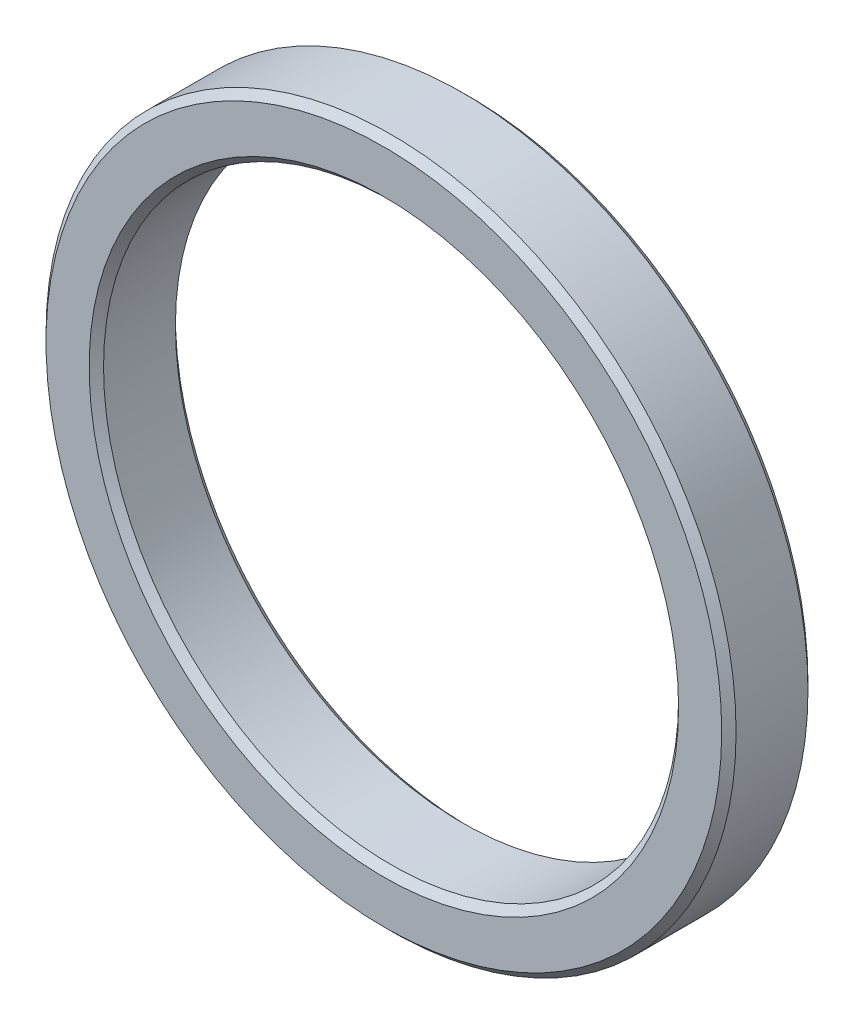
from build123d import *

# Parameters (mm, degrees)
SKETCH_1_R      = 24
SKETCH_1_R_2    = 20
EXTRUDE_1_DEPTH = 6
CHAMFER_1_SIZE  = 0.5


with BuildPart() as part:
    # 草图1 → 拉伸1 (new body)
    with BuildSketch(Plane.XY):
        Circle(SKETCH_1_R)
        Circle(SKETCH_1_R_2, mode=Mode.SUBTRACT)
    extrude(amount=EXTRUDE_1_DEPTH)

    # 倒角1
    chamfer_1_edges = [part.edges().sort_by_distance(p)[0] for p in [
        (-24, 0, 0),
        (-24, 0, 6),
        (-20, 0, 0),
        (-20, 0, 6),
    ]]
    chamfer(chamfer_1_edges, length=CHAMFER_1_SIZE)


solid = part.part
